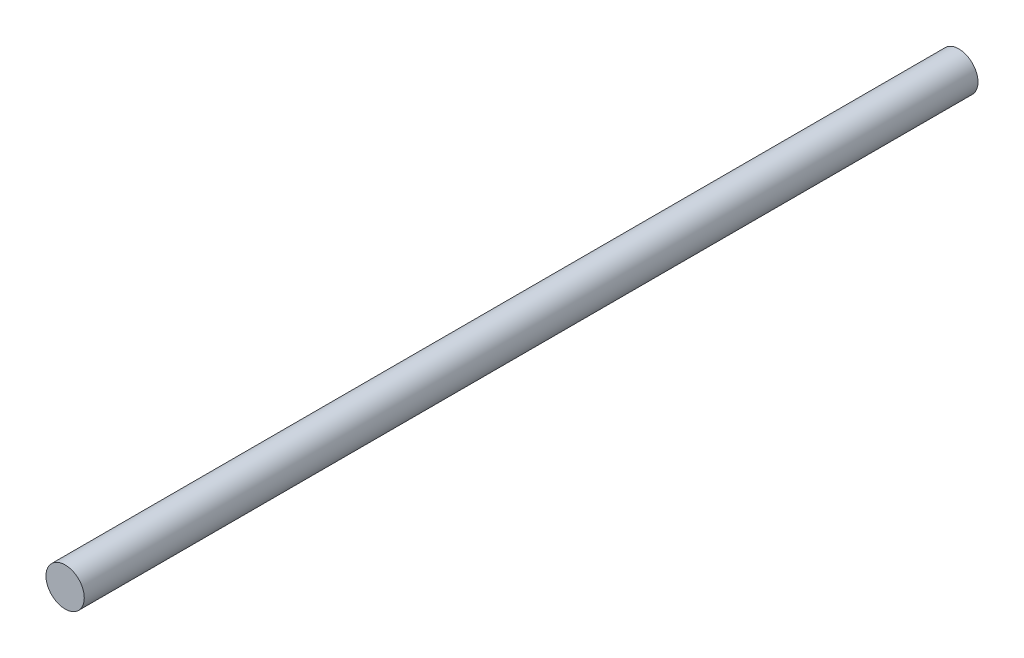
from build123d import *

# Parameters (mm, degrees)
SKETCH_1_R      = 1.5
EXTRUDE_1_DEPTH = 70


with BuildPart() as part:
    # 草图1 → 凸台-拉伸1 (new body)
    with BuildSketch(Plane.XY):
        Circle(SKETCH_1_R)
    extrude(amount=EXTRUDE_1_DEPTH)


solid = part.part
